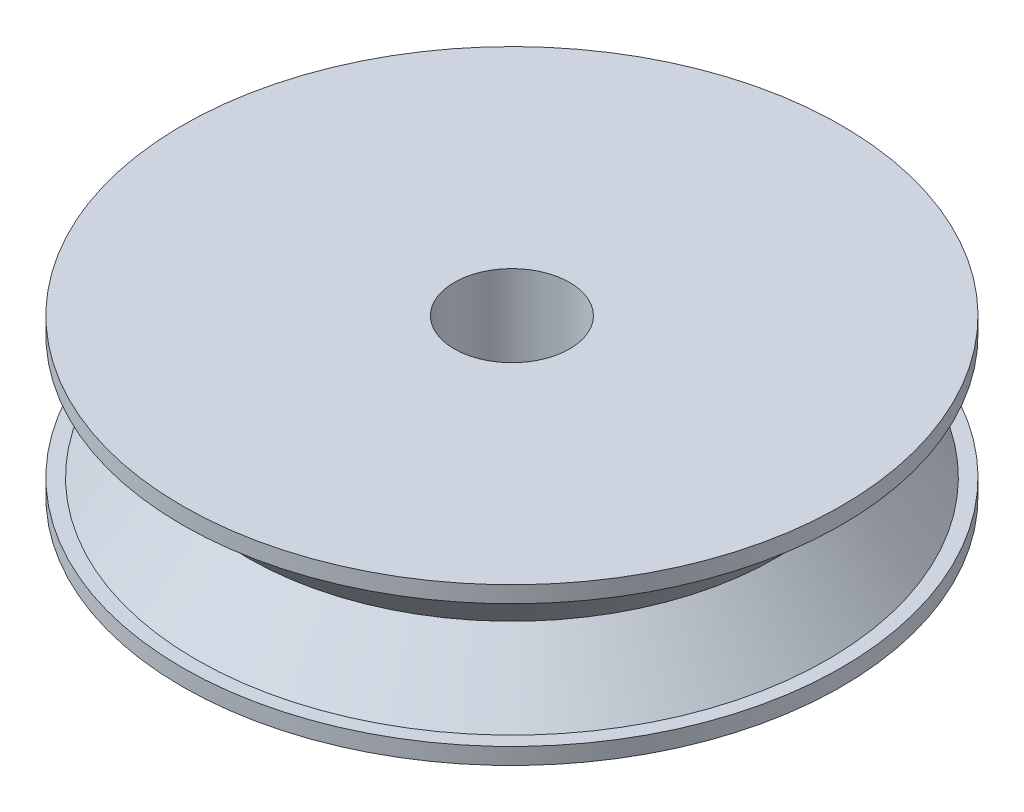
from build123d import *

# Parameters (mm, degrees)
SKETCH1_R           = 10
BOSS_EXTRUDE1_DEPTH = 4.75
SKETCH3_R           = 1.75
CUT_EXTRUDE1_DEPTH  = 4.75


with BuildPart() as part:
    # Sketch1 → Boss-Extrude1 (new body)
    with BuildSketch(Plane(origin=(0, 0, 0), x_dir=(1, 0, 0), z_dir=(0, 1, 0))):
        with Locations(Location((0, 0, 0), (0, 0, 270))):
            Circle(SKETCH1_R)
    extrude(amount=BOSS_EXTRUDE1_DEPTH)

    # Sketch2 → Cut-Revolve1 (revolve, cut)
    with BuildSketch(Plane(origin=(0, 0, 0), x_dir=(0, 0, -1), z_dir=(1, 0, 0)), mode=Mode.PRIVATE) as cut_revolve1_sk:
        Polygon((9.578947368, 4.25), (8, 2.375), (9.578947368, 0.5), (10, 0.5), (10, 4.25), align=None)
    revolve(cut_revolve1_sk.sketch.rotate(Axis((0, 4.75, 0), (0, -1, 0)), 180), axis=Axis((0, 4.75, 0), (0, -1, 0)), mode=Mode.SUBTRACT)

    # Sketch3 → Cut-Extrude1 (cut)
    with BuildSketch(Plane(origin=(0, 4.75, 0), x_dir=(1, 0, 0), z_dir=(0, 1, 0))):
        with Locations(Location((0, 0, 0), (0, 0, 270))):
            Circle(SKETCH3_R)
    extrude(amount=-CUT_EXTRUDE1_DEPTH, mode=Mode.SUBTRACT)


solid = part.part
